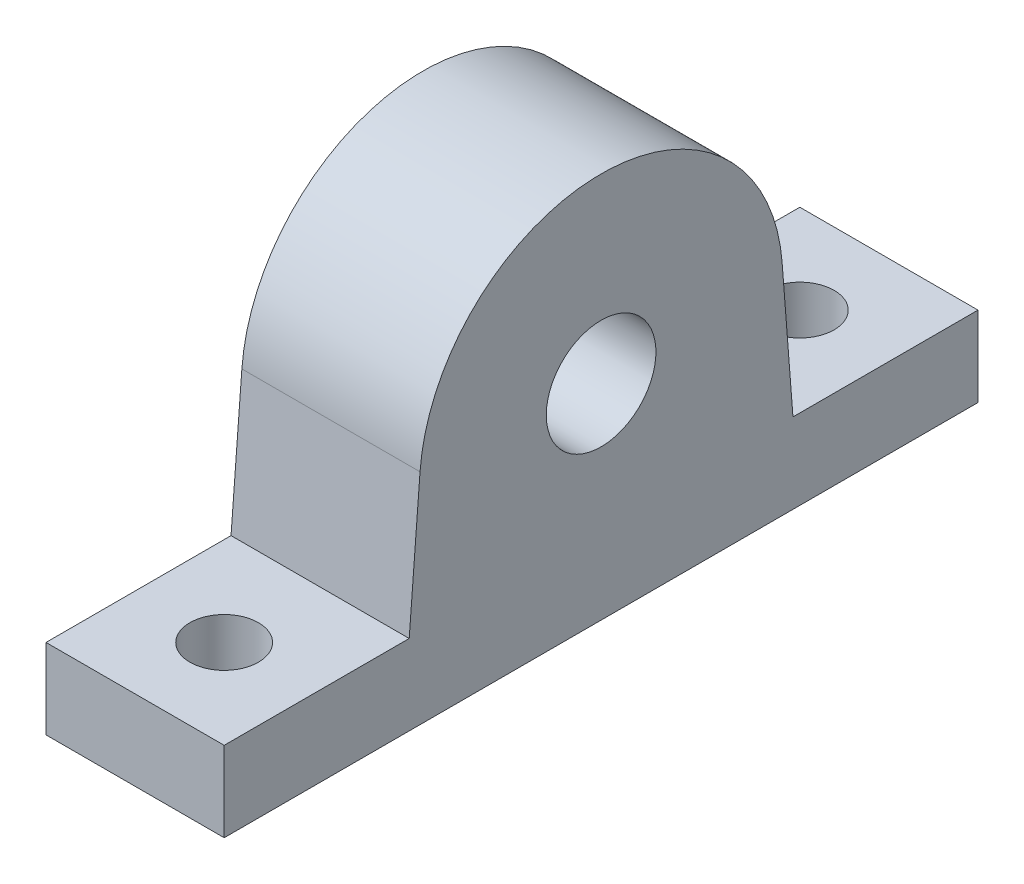
from build123d import *

# Parameters (mm, degrees)
SKETCH1_R               = 4
BOSS_EXTRUDE1_DEPTH     = 13
CUT_EXTRUDE1_DEPTH      = 38.750758176
CUT_EXTRUDE1_DEPTH_BACK = 38.750758176
SKETCH2_R               = 2.5


with BuildPart() as part:
    # Sketch1 → Boss-Extrude1 (new body)
    with BuildSketch(Plane(origin=(0, 0, 0), x_dir=(0, 0, -1), z_dir=(1, 0, 0))):
        with BuildLine():
            Line((27.5, -14.95), (-27.5, -14.95))
            Line((-27.5, -14.95), (-27.5, -9.107766946))
            Line((-27.5, -9.107766946), (-14, -9.107766946))
            Line((-14, -9.107766946), (-13.209942251, 1.029526948))
            ThreePointArc((-13.209942251, 1.029526948), (0, 13.25), (13.209942251, 1.029526948))
            Line((13.209942251, 1.029526948), (14, -9.107766946))
            Line((14, -9.107766946), (27.5, -9.107766946))
            Line((27.5, -9.107766946), (27.5, -14.95))
        make_face()
        with Locations(Location((0, 0, 0), (0, 0, 180))):
            Circle(SKETCH1_R, mode=Mode.SUBTRACT)
    extrude(amount=BOSS_EXTRUDE1_DEPTH)

    # Sketch2 → Cut-Extrude1 (cut, two sides: drawn at the far end of the back side and taken through both)
    with BuildSketch(Plane(origin=(0, -9.107766946, 0), x_dir=(1, 0, 0), z_dir=(0, 1, 0)).offset(-CUT_EXTRUDE1_DEPTH_BACK)):
        with Locations(Location((6.5, 21, 0), (0, 0, 270))):
            Circle(SKETCH2_R)
        with Locations(Location((6.5, -21, 0), (0, 0, 90))):
            Circle(SKETCH2_R)
    extrude(amount=CUT_EXTRUDE1_DEPTH + CUT_EXTRUDE1_DEPTH_BACK, mode=Mode.SUBTRACT)


solid = part.part
